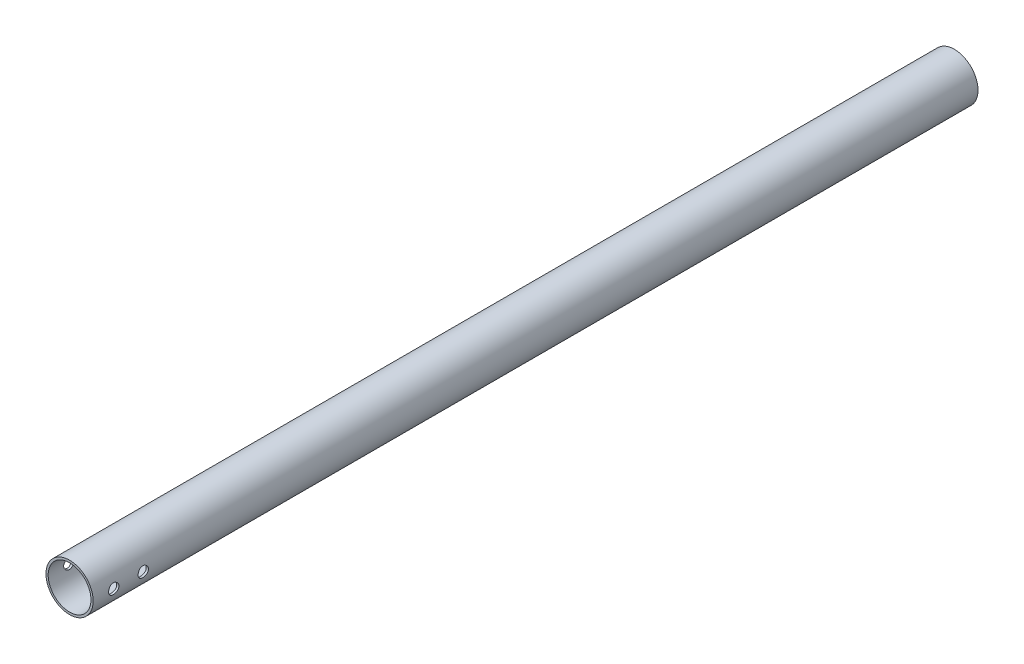
from build123d import *

# Parameters (mm, degrees)
ESBO_O1_R                  = 8
ESBO_O1_R_2                = 7.25
RESSALTO_EXTRUS_O1_DEPTH   = 300
CORTE_EXTRUS_O1_DEPTH      = 300
CORTE_EXTRUS_O1_DEPTH_BACK = 300
ESBO_O2_R                  = 1.75
CUT_EXTRUDE1_REACH         = 302.213
SKETCH2_R                  = 3.5


with BuildPart() as part:
    # Esboço1 → Ressalto-extrusão1 (new body)
    with BuildSketch(Plane.XY):
        Circle(ESBO_O1_R)
        Circle(ESBO_O1_R_2, mode=Mode.SUBTRACT)
    extrude(amount=RESSALTO_EXTRUS_O1_DEPTH)

    # Esboço2 → Corte-extrusão1 (cut, two sides: drawn at the far end of the back side and taken through both)
    with BuildSketch(Plane(origin=(0, 0, 0), x_dir=(0, 0, -1), z_dir=(1, 0, 0)).offset(-CORTE_EXTRUS_O1_DEPTH_BACK)):
        with Locations((-293, 0)):
            Circle(ESBO_O2_R)
        with Locations((-283, 0)):
            Circle(ESBO_O2_R)
    extrude(amount=CORTE_EXTRUS_O1_DEPTH + CORTE_EXTRUS_O1_DEPTH_BACK, mode=Mode.SUBTRACT)

    # Sketch2 → Cut-Extrude1 (cut, up to next)
    with BuildSketch(Plane(origin=(0, 0, 0), x_dir=(1, 0, 0), z_dir=(0, 1, 0)), mode=Mode.PRIVATE) as cut_extrude1_sk1:
        with Locations((0, -147)):
            Circle(SKETCH2_R)
    cut_extrude1_tool1 = extrude(cut_extrude1_sk1.sketch, amount=-CUT_EXTRUDE1_REACH, mode=Mode.PRIVATE) & part.part
    add(cut_extrude1_tool1.solids().sort_by_distance((0, 0, 147))[0], mode=Mode.SUBTRACT)


solid = part.part
